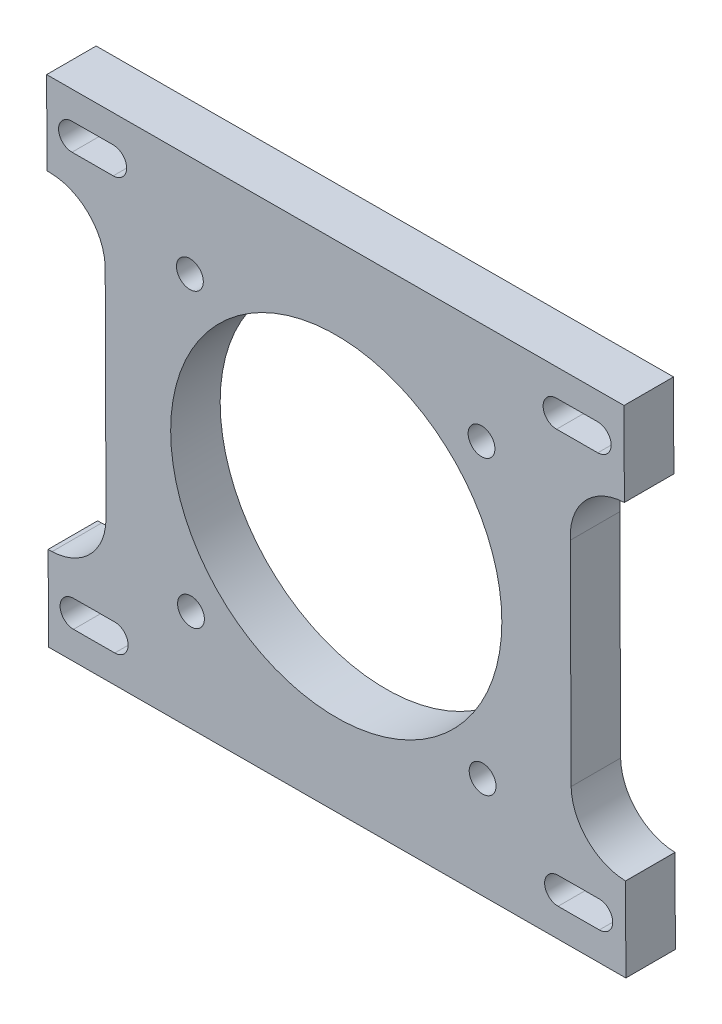
from build123d import *

# Parameters (mm, degrees)
SKETCH1_R           = 40.149801581
SKETCH1_R_2         = 3.249983939
BOSS_EXTRUDE1_DEPTH = 12


with BuildPart() as part:
    # Sketch1 → Boss-Extrude1 (new body)
    with BuildSketch(Plane.XY):
        with BuildLine():
            Line((-68.174111389, 53.990948604), (71.824239973, 54.508639483))
            Line((71.824239973, 54.508639483), (71.899444011, 34.171326758))
            Line((71.899444011, 34.171326758), (71.89945068, 34.169523305))
            ThreePointArc((71.89945068, 34.169523305), (62.293513488, 29.701666637), (58.799882097, 19.700151139))
            Line((58.799882097, 19.700151139), (58.988814164, -31.392458227))
            Line((58.988814164, -31.392458227), (58.990835115, -31.938981122))
            ThreePointArc((58.990835115, -31.938981122), (62.935928372, -41.173957513), (72.156427876, -45.152768721))
            Line((72.156427876, -45.152768721), (72.192770973, -45.15263433))
            Line((72.192770973, -45.15263433), (72.267975011, -65.489947056))
            Line((72.267975011, -65.489947056), (-67.730376351, -66.007637935))
            Line((-67.730376351, -66.007637935), (-67.806147753, -45.51689395))
            Line((-67.806147753, -45.51689395), (-66.849217099, -45.513355378))
            ThreePointArc((-66.849217099, -45.513355378), (-57.65839533, -41.466462132), (-53.781707876, -32.202562082))
            Line((-53.781707876, -32.202562082), (-53.783728828, -31.656039187))
            Line((-53.783728828, -31.656039187), (-53.972660895, 19.436570179))
            ThreePointArc((-53.972660895, 19.436570179), (-57.560711521, 29.434286706), (-67.23952414, 33.810247094))
            Line((-67.23952414, 33.810247094), (-68.099474715, 33.807067138))
            Line((-68.099474715, 33.807067138), (-68.174111389, 53.990948604))
        make_face()
        with Locations((2.046931811, -5.749499226)):
            Circle(SKETCH1_R, mode=Mode.SUBTRACT)
        with Locations((-33.438727493, 29.474686699)):
            Circle(SKETCH1_R_2, mode=Mode.SUBTRACT)
        with Locations((-33.177254114, -41.235158529)):
            Circle(SKETCH1_R_2, mode=Mode.SUBTRACT)
        with Locations((37.532591115, -40.973685151)):
            Circle(SKETCH1_R_2, mode=Mode.SUBTRACT)
        with Locations((37.271117736, 29.736160078)):
            Circle(SKETCH1_R_2, mode=Mode.SUBTRACT)
        with BuildLine():
            Line((65.81073891, -52.110366387), (55.810856699, -52.147344307))
            ThreePointArc((55.810856699, -52.147344307), (52.572912804, -55.40932385), (55.834892347, -58.647267744))
            Line((55.834892347, -58.647267744), (65.834774558, -58.610289825))
            ThreePointArc((65.834774558, -58.610289825), (69.072718453, -55.348310282), (65.81073891, -52.110366387))
        make_face(mode=Mode.SUBTRACT)
        with BuildLine():
            Line((-61.654525972, -59.235157648), (-51.654643761, -59.198179728))
            ThreePointArc((-51.654643761, -59.198179728), (-48.416699866, -55.936200186), (-51.678679409, -52.698256291))
            Line((-51.678679409, -52.698256291), (-61.67856162, -52.735234211))
            ThreePointArc((-61.67856162, -52.735234211), (-64.916505515, -55.997213753), (-61.654525972, -59.235157648))
        make_face(mode=Mode.SUBTRACT)
        with BuildLine():
            Line((55.465113149, 41.351554371), (65.46499536, 41.388532291))
            ThreePointArc((65.46499536, 41.388532291), (68.702939255, 44.650511834), (65.440959712, 47.888455729))
            Line((65.440959712, 47.888455729), (55.441077501, 47.851477809))
            ThreePointArc((55.441077501, 47.851477809), (52.203133606, 44.589498266), (55.465113149, 41.351554371))
        make_face(mode=Mode.SUBTRACT)
        with BuildLine():
            Line((-52.048458607, 47.300565825), (-62.048340818, 47.263587905))
            ThreePointArc((-62.048340818, 47.263587905), (-65.286284713, 44.001608363), (-62.024305171, 40.763664468))
            Line((-62.024305171, 40.763664468), (-52.024422959, 40.800642388))
            ThreePointArc((-52.024422959, 40.800642388), (-48.786479064, 44.06262193), (-52.048458607, 47.300565825))
        make_face(mode=Mode.SUBTRACT)
    extrude(amount=BOSS_EXTRUDE1_DEPTH)


solid = part.part
